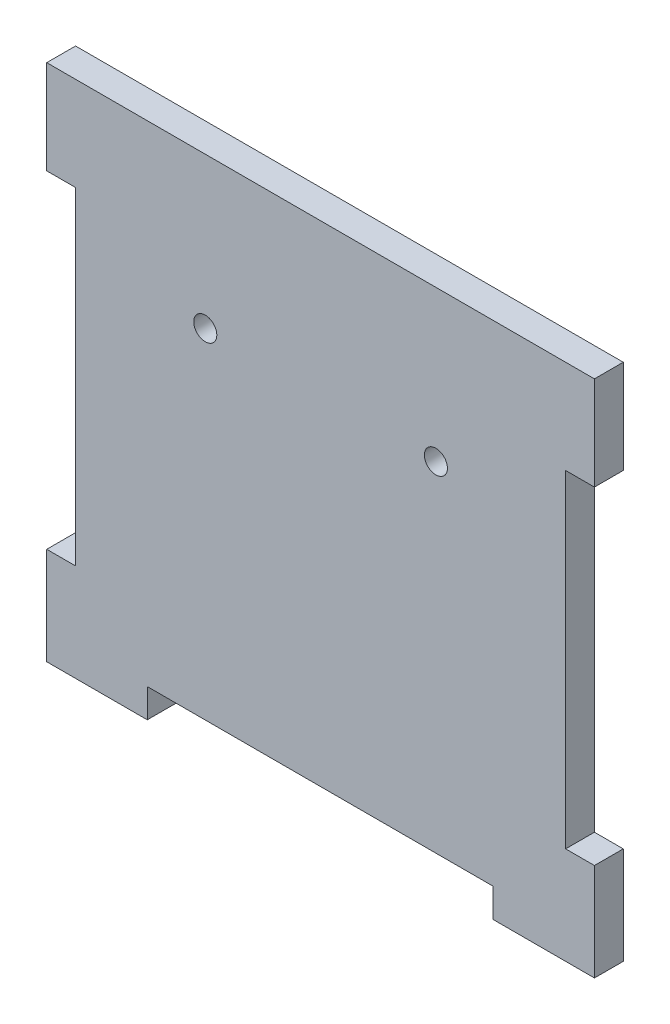
from build123d import *

# Parameters (mm, degrees)
SKIZZE1_R                       = 2
AUFSATZ_LINEAR_AUSTRAGEN1_DEPTH = 5


with BuildPart() as part:
    # Skizze1 → Aufsatz-Linear austragen1 (new body)
    # profile 1 of 4: a face of its own
    with BuildSketch(Plane.XY):
        Polygon((-56.378328771, 75.078341375), (-56.378328771, 63.819239112), (-56.378328771, 6.977133849), (-56.378328771, -4.921658625), (-43.939454059, -4.921658625), (16.060545941, -4.921658625), (28.621671229, -4.921658625), (28.621671229, 6.977133849), (28.621671229, 63.819239112), (28.621671229, 75.078341375), align=None)
        with Locations((-33.878328771, 53.901870786)):
            Circle(SKIZZE1_R, mode=Mode.SUBTRACT)
        with Locations((6.121671229, 53.901870786)):
            Circle(SKIZZE1_R, mode=Mode.SUBTRACT)
    # profile 2 of 4: a face of its own
    with BuildSketch(Plane.XY):
        Polygon((-61.378328771, 80.078341375), (-61.378328771, 63.819239112), (-56.378328771, 63.819239112), (-56.378328771, 75.078341375), (28.621671229, 75.078341375), (28.621671229, 63.819239112), (33.621671229, 63.819239112), (33.621671229, 80.078341375), align=None)
    # profile 3 of 4: a face of its own
    with BuildSketch(Plane.XY):
        Polygon((-56.378328771, -4.921658625), (-56.378328771, 6.977133849), (-61.378328771, 6.977133849), (-61.378328771, -9.921658625), (-43.939454059, -9.921658625), (-43.939454059, -4.921658625), align=None)
    # profile 4 of 4: a face of its own
    with BuildSketch(Plane.XY):
        Polygon((33.621671229, 6.977133849), (28.621671229, 6.977133849), (28.621671229, -4.921658625), (16.060545941, -4.921658625), (16.060545941, -9.921658625), (33.621671229, -9.921658625), align=None)
    extrude(amount=AUFSATZ_LINEAR_AUSTRAGEN1_DEPTH)


solid = part.part
